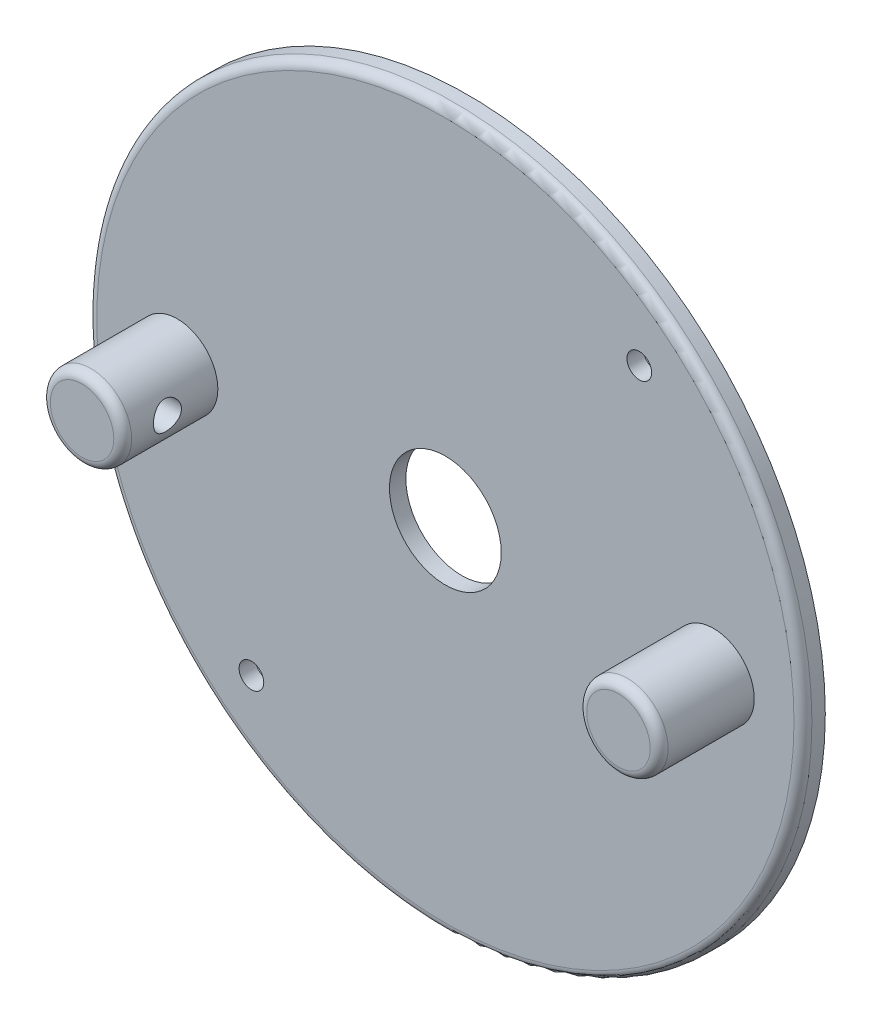
from build123d import *

# Parameters (mm, degrees)
SKETCH1_R           = 50.8
BOSS_EXTRUDE1_DEPTH = 3.175
SKETCH2_R           = 48.26
CUT_EXTRUDE1_DEPTH  = 0.84582
SKETCH3_R           = 7.9375
CUT_EXTRUDE2_DEPTH  = 21.1328
SKETCH4_R           = 1.7526
CUT_EXTRUDE3_DEPTH  = 72.912172996
SKETCH5_R           = 5.7785
BOSS_EXTRUDE2_DEPTH = 13.5128
FILLET1_R           = 1.27
FILLET2_R           = 1.27


with BuildPart() as part:
    # Sketch1 → Boss-Extrude1 (new body)
    with BuildSketch(Plane.XY):
        Circle(SKETCH1_R)
    extrude(amount=BOSS_EXTRUDE1_DEPTH)

    # Sketch2 → Cut-Extrude1 (cut)
    with BuildSketch(Plane(origin=(0, 0, 0), x_dir=(-1, 0, 0), z_dir=(0, 0, -1))):
        Circle(SKETCH2_R)
    extrude(amount=-CUT_EXTRUDE1_DEPTH, mode=Mode.SUBTRACT)

    # Sketch3 → Cut-Extrude2 (cut)
    with BuildSketch(Plane.XY.offset(3.175)):
        Circle(SKETCH3_R)
    extrude(amount=-CUT_EXTRUDE2_DEPTH, mode=Mode.SUBTRACT)

    # Sketch4 → Cut-Extrude3 (cut, through all)
    with BuildSketch(Plane.XY.offset(3.175)):
        with Locations((27.55148392, 32.834579943)):
            Circle(SKETCH4_R)
        with Locations((-27.55148392, -32.834579943)):
            Circle(SKETCH4_R)
    extrude(amount=-CUT_EXTRUDE3_DEPTH, mode=Mode.SUBTRACT)

    # Sketch5 → Boss-Extrude2 (add)
    with BuildSketch(Plane.XY.offset(3.175)):
        with Locations((-38.1, 0)):
            Circle(SKETCH5_R)
        with Locations((38.1, 0)):
            Circle(SKETCH5_R)
    extrude(amount=BOSS_EXTRUDE2_DEPTH)

    # Sketch8 → 5/32 (0.15625) Diameter Hole1 (revolve, cut)
    with BuildSketch(Plane(origin=(-32.325156325, 0.205530485, 10.329557964), x_dir=(-0.03556813784183403, 0.9993672536012296, 0), z_dir=(0, 0, 1))):
        Polygon((0, 0), (0, 8.761532791), (1.984375, 7.5692), (1.984375, 0), align=None)
    f_5_32_0_15625_diameter_hole1 = revolve(axis=Axis((-25.979174265, 0.43138816, 10.329557964), (-0.9993672536012297, -0.03556813784183403, 0)), mode=Mode.SUBTRACT)

    # Mirror1: 5/32 (0.15625) Diameter Hole1 across plane
    add(f_5_32_0_15625_diameter_hole1.mirror(Plane(origin=(0, 0, 0), x_dir=(0, 0, 1), z_dir=(1, 0, 0))), mode=Mode.SUBTRACT)

    # Fillet1
    fillet1_edges = [part.edges().sort_by_distance(p)[0] for p in [
        (-43.8785, 0, 16.6878),
        (32.3215, 0, 16.6878),
    ]]
    fillet(fillet1_edges, radius=FILLET1_R)

    # Fillet2
    fillet2_edges = [part.edges().sort_by_distance(p)[0] for p in [
        (-50.8, 0, 3.175),
    ]]
    fillet(fillet2_edges, radius=FILLET2_R)


solid = part.part
